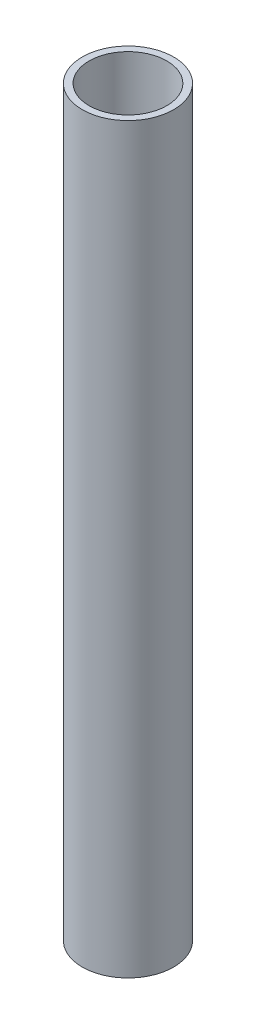
from build123d import *

# Parameters (mm, degrees)
SKETCH_1_R      = 16
SKETCH_1_R_2    = 13.6
EXTRUDE_1_DEPTH = 260


with BuildPart() as part:
    # 草图1 → 凸台-拉伸1 (new body)
    with BuildSketch(Plane(origin=(0, 0, 0), x_dir=(1, 0, 0), z_dir=(0, 1, 0))):
        with Locations(Location((0, 0, 0), (0, 0, 270))):
            Circle(SKETCH_1_R)
        with Locations(Location((0, 0, 0), (0, 0, 270))):
            Circle(SKETCH_1_R_2, mode=Mode.SUBTRACT)
    extrude(amount=EXTRUDE_1_DEPTH)


solid = part.part
